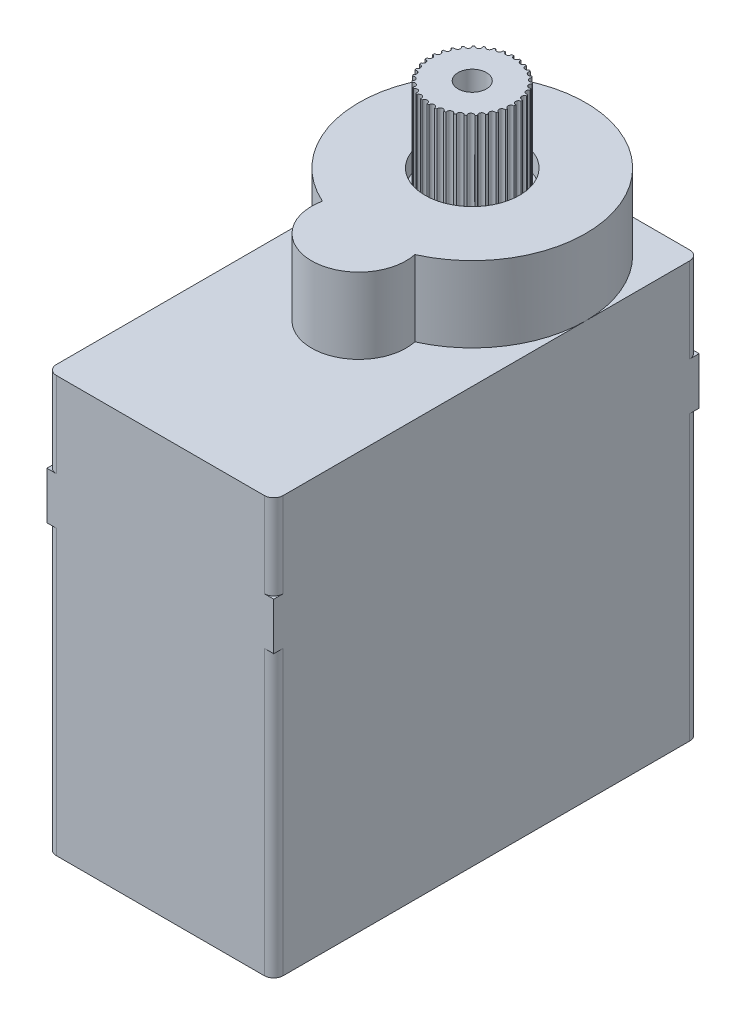
from build123d import *

# Parameters (mm, degrees)
Y_KSEKLIK_EKSTR_ZYON1_DEPTH  = 1
Y_KSEKLIK_EKSTR_ZYON2_DEPTH  = 5
IZIM3_W                      = 4
IZIM3_H                      = 1
KES_EKSTR_ZYON1_DEPTH        = 1
RADYUS1_R                    = 0.1
Y_KSEKLIK_EKSTR_ZYON4_DEPTH  = 9
IZIM6_W                      = 12
IZIM6_H                      = 22.5
Y_KSEKLIK_EKSTR_ZYON5_DEPTH  = 2.5
Y_KSEKLIK_EKSTR_ZYON6_DEPTH  = 3.5
Y_KSEKLIK_EKSTR_ZYON7_DEPTH  = 1
KES_EKSTR_ZYON2_DEPTH        = 1
Y_KSEKLIK_EKSTR_ZYON8_START  = 3
Y_KSEKLIK_EKSTR_ZYON8_DEPTH  = 3
RADYUS2_R                    = 0.5
Y_KSEKLIK_EKSTR_ZYON9_START  = 1
Y_KSEKLIK_EKSTR_ZYON9_DEPTH  = 1
IZIM11_R                     = 2.5
KES_EKSTR_ZYON3_DEPTH        = 10
IZIM15_R                     = 0.25
Y_KSEKLIK_EKSTR_ZYON12_DEPTH = 11
IZIM19_R                     = 2.25
Y_KSEKLIK_EKSTR_ZYON17_DEPTH = 5
IZIM20_R                     = 4.75
Y_KSEKLIK_EKSTR_ZYON18_DEPTH = 3
IZIM21_R                     = 0.75
KES_EKSTR_ZYON5_DEPTH        = 10
IZIM22_R                     = 0.5
Y_KSEKLIK_EKSTR_ZYON19_DEPTH = 5
IZIM23_R                     = 4
Y_KSEKLIK_EKSTR_ZYON20_DEPTH = 2
IZIM24_R                     = 0.75
Y_KSEKLIK_EKSTR_ZYON21_DEPTH = 7
IZIM25_R                     = 3.5
Y_KSEKLIK_EKSTR_ZYON22_DEPTH = 1
IZIM26_R                     = 4.5
Y_KSEKLIK_EKSTR_ZYON23_DEPTH = 1
KES_EKSTR_ZYON7_DEPTH        = 30
Y_KSEKLIK_EKSTR_ZYON33_DEPTH = 1
Y_KSEKLIK_EKSTR_ZYON34_DEPTH = 14
IZIM37_W                     = 8
IZIM37_H                     = 6
Y_KSEKLIK_EKSTR_ZYON36_DEPTH = 1
IZIM39_W                     = 4
IZIM39_H                     = 1
Y_KSEKLIK_EKSTR_ZYON37_DEPTH = 0.1
IZIM40_R                     = 0.4
Y_KSEKLIK_EKSTR_ZYON38_DEPTH = 2
IZIM41_R                     = 0.15
KES_EKSTR_ZYON8_DEPTH        = 5


with BuildPart() as part:
    # Çizim1 → Yükseklik-Ekstrüzyon1 (new body)
    with BuildSketch(Plane(origin=(0, 0, 0), x_dir=(1, 0, 0), z_dir=(0, 1, 0))):
        with BuildLine():
            Line((-5.5, 11.25), (5.5, 11.25))
            ThreePointArc((5.5, 11.25), (5.853553391, 11.103553391), (6, 10.75))
            Line((6, 10.75), (6, -10.75))
            ThreePointArc((6, -10.75), (5.853553391, -11.103553391), (5.5, -11.25))
            Line((5.5, -11.25), (-5.5, -11.25))
            ThreePointArc((-5.5, -11.25), (-5.853553391, -11.103553391), (-6, -10.75))
            Line((-6, -10.75), (-6, 10.75))
            ThreePointArc((-6, 10.75), (-5.853553391, 11.103553391), (-5.5, 11.25))
        make_face()
    extrude(amount=Y_KSEKLIK_EKSTR_ZYON1_DEPTH)

    # Çizim2 → Yükseklik-Ekstrüzyon2 (add)
    with BuildSketch(Plane(origin=(0, 1, 0), x_dir=(1, 0, 0), z_dir=(0, 1, 0))):
        with BuildLine():
            Line((-5.5, 11.25), (5.5, 11.25))
            ThreePointArc((5.5, 11.25), (5.853553391, 11.103553391), (6, 10.75))
            Line((6, 10.75), (6, -10.75))
            ThreePointArc((6, -10.75), (5.853553391, -11.103553391), (5.5, -11.25))
            Line((5.5, -11.25), (-5.5, -11.25))
            ThreePointArc((-5.5, -11.25), (-5.853553391, -11.103553391), (-6, -10.75))
            Line((-6, -10.75), (-6, 10.75))
            ThreePointArc((-6, 10.75), (-5.853553391, 11.103553391), (-5.5, 11.25))
        make_face()
        with BuildLine():
            Line((-5, 9.25), (-5, -9.25))
            ThreePointArc((-5, -9.25), (-4.292893219, -9.542893219), (-4, -10.25))
            Line((-4, -10.25), (4, -10.25))
            ThreePointArc((4, -10.25), (4.292893219, -9.542893219), (5, -9.25))
            Line((5, -9.25), (5, 9.25))
            ThreePointArc((5, 9.25), (4.292893219, 9.542893219), (4, 10.25))
            Line((4, 10.25), (-4, 10.25))
            ThreePointArc((-4, 10.25), (-4.292893219, 9.542893219), (-5, 9.25))
        make_face(mode=Mode.SUBTRACT)
    extrude(amount=Y_KSEKLIK_EKSTR_ZYON2_DEPTH)

    # Çizim3 → Kes-Ekstrüzyon1 (cut)
    with BuildSketch(Plane(origin=(0, 6, 0), x_dir=(1, 0, 0), z_dir=(0, 1, 0))):
        with Locations((0, -10.75)):
            Rectangle(IZIM3_W, IZIM3_H)
    extrude(amount=-KES_EKSTR_ZYON1_DEPTH, mode=Mode.SUBTRACT)

    # Radyus1
    radyus1_edges = [part.edges().sort_by_distance(p)[0] for p in [
        (2, 5, 10.75),
        (-2, 5, 10.75),
    ]]
    fillet(radyus1_edges, radius=RADYUS1_R)

    # Çizim4 → Yükseklik-Ekstrüzyon4 (add)
    with BuildSketch(Plane(origin=(0, 6, 0), x_dir=(1, 0, 0), z_dir=(0, 1, 0))):
        with BuildLine():
            Line((5.5, 11.25), (-5.5, 11.25))
            ThreePointArc((-5.5, 11.25), (-5.853553391, 11.103553391), (-6, 10.75))
            Line((-6, 10.75), (-6, -10.75))
            ThreePointArc((-6, -10.75), (-5.853553391, -11.103553391), (-5.5, -11.25))
            Line((-5.5, -11.25), (-2, -11.25))
            Line((-2, -11.25), (2, -11.25))
            Line((2, -11.25), (5.5, -11.25))
            ThreePointArc((5.5, -11.25), (5.853553391, -11.103553391), (6, -10.75))
            Line((6, -10.75), (6, 10.75))
            ThreePointArc((6, 10.75), (5.853553391, 11.103553391), (5.5, 11.25))
        make_face()
        with BuildLine():
            ThreePointArc((-5, 9.25), (-4.292893219, 9.542893219), (-4, 10.25))
            Line((-4, 10.25), (4, 10.25))
            ThreePointArc((4, 10.25), (4.292893219, 9.542893219), (5, 9.25))
            Line((5, 9.25), (5, -9.25))
            ThreePointArc((5, -9.25), (4.292893219, -9.542893219), (4, -10.25))
            Line((4, -10.25), (2, -10.25))
            Line((2, -10.25), (-2, -10.25))
            Line((-2, -10.25), (-4, -10.25))
            ThreePointArc((-4, -10.25), (-4.292893219, -9.542893219), (-5, -9.25))
            Line((-5, -9.25), (-5, 9.25))
        make_face(mode=Mode.SUBTRACT)
    extrude(amount=Y_KSEKLIK_EKSTR_ZYON4_DEPTH)

    # Çizim6 → Yükseklik-Ekstrüzyon5 (add)
    with BuildSketch(Plane(origin=(0, 15, 0), x_dir=(1, 0, 0), z_dir=(0, 1, 0))):
        Rectangle(IZIM6_W, IZIM6_H)
        with BuildLine():
            Line((-4, 10.25), (4, 10.25))
            ThreePointArc((4, 10.25), (4.292893219, 9.542893219), (5, 9.25))
            Line((5, 9.25), (5, -9.25))
            ThreePointArc((5, -9.25), (4.292893219, -9.542893219), (4, -10.25))
            Line((4, -10.25), (-4, -10.25))
            ThreePointArc((-4, -10.25), (-4.292893219, -9.542893219), (-5, -9.25))
            Line((-5, -9.25), (-5, 9.25))
            ThreePointArc((-5, 9.25), (-4.292893219, 9.542893219), (-4, 10.25))
        make_face(mode=Mode.SUBTRACT)
    extrude(amount=Y_KSEKLIK_EKSTR_ZYON5_DEPTH)

    # Çizim7 → Yükseklik-Ekstrüzyon6 (add)
    with BuildSketch(Plane(origin=(0, 17.5, 0), x_dir=(1, 0, 0), z_dir=(0, 1, 0))):
        with BuildLine():
            Line((5.5, 11.25), (-5.5, 11.25))
            ThreePointArc((-5.5, 11.25), (-5.853553391, 11.103553391), (-6, 10.75))
            Line((-6, 10.75), (-6, -10.75))
            ThreePointArc((-6, -10.75), (-5.853553391, -11.103553391), (-5.5, -11.25))
            Line((-5.5, -11.25), (5.5, -11.25))
            ThreePointArc((5.5, -11.25), (5.853553391, -11.103553391), (6, -10.75))
            Line((6, -10.75), (6, 10.75))
            ThreePointArc((6, 10.75), (5.853553391, 11.103553391), (5.5, 11.25))
        make_face()
        with BuildLine():
            Line((-5, -9.25), (-5, 9.25))
            ThreePointArc((-5, 9.25), (-4.292893219, 9.542893219), (-4, 10.25))
            Line((-4, 10.25), (4, 10.25))
            ThreePointArc((4, 10.25), (4.292893219, 9.542893219), (5, 9.25))
            Line((5, 9.25), (5, -9.25))
            ThreePointArc((5, -9.25), (4.292893219, -9.542893219), (4, -10.25))
            Line((4, -10.25), (-4, -10.25))
            ThreePointArc((-4, -10.25), (-4.292893219, -9.542893219), (-5, -9.25))
        make_face(mode=Mode.SUBTRACT)
    extrude(amount=Y_KSEKLIK_EKSTR_ZYON6_DEPTH)

    # Çizim8 → Yükseklik-Ekstrüzyon7 (add)
    with BuildSketch(Plane(origin=(0, 21, 0), x_dir=(1, 0, 0), z_dir=(0, 1, 0))):
        with BuildLine():
            Line((-5.5, 11.25), (5.5, 11.25))
            ThreePointArc((5.5, 11.25), (5.853553391, 11.103553391), (6, 10.75))
            Line((6, 10.75), (6, -10.75))
            ThreePointArc((6, -10.75), (5.853553391, -11.103553391), (5.5, -11.25))
            Line((5.5, -11.25), (-5.5, -11.25))
            ThreePointArc((-5.5, -11.25), (-5.853553391, -11.103553391), (-6, -10.75))
            Line((-6, -10.75), (-6, 10.75))
            ThreePointArc((-6, 10.75), (-5.853553391, 11.103553391), (-5.5, 11.25))
        make_face()
    extrude(amount=Y_KSEKLIK_EKSTR_ZYON7_DEPTH)

    # Çizim9 → Kes-Ekstrüzyon2 (cut)
    with BuildSketch(Plane(origin=(0, 22, 0), x_dir=(1, 0, 0), z_dir=(0, 1, 0))):
        with BuildLine():
            ThreePointArc((1.015291078, 0.354166667), (0, 10.25), (-1.015291078, 0.354166667))
            ThreePointArc((-1.015291078, 0.354166667), (0, -2.25), (1.015291078, 0.354166667))
        make_face()
    extrude(amount=-KES_EKSTR_ZYON2_DEPTH, mode=Mode.SUBTRACT)

    # Çizim9<3> → Yükseklik-Ekstrüzyon8 (add)
    with BuildSketch(Plane(origin=(0, 22, 0), x_dir=(1, 0, 0), z_dir=(0, 1, 0)).offset(Y_KSEKLIK_EKSTR_ZYON8_START)):
        with BuildLine():
            ThreePointArc((2.445144707, -0.229166667), (0, 11.25), (-2.445144707, -0.229166667))
            ThreePointArc((-2.445144707, -0.229166667), (0, -3.25), (2.445144707, -0.229166667))
        make_face()
        with BuildLine():
            ThreePointArc((1.015291078, 0.354166667), (0, 10.25), (-1.015291078, 0.354166667))
            ThreePointArc((-1.015291078, 0.354166667), (0, -2.25), (1.015291078, 0.354166667))
        make_face(mode=Mode.SUBTRACT)
    extrude(amount=-Y_KSEKLIK_EKSTR_ZYON8_DEPTH)

    # Radyus2
    radyus2_edges = [part.edges().sort_by_distance(p)[0] for p in [
        (1.015291078, 23, -0.354166667),
        (-1.015291078, 23, -0.354166667),
    ]]
    fillet(radyus2_edges, radius=RADYUS2_R)

    # Çizim10 → Yükseklik-Ekstrüzyon9 (add)
    with BuildSketch(Plane(origin=(0, 25, 0), x_dir=(1, 0, 0), z_dir=(0, 1, 0)).offset(Y_KSEKLIK_EKSTR_ZYON9_START)):
        with BuildLine():
            ThreePointArc((2.445144707, -0.229166667), (0, 11.25), (-2.445144707, -0.229166667))
            ThreePointArc((-2.445144707, -0.229166667), (0, -3.25), (2.445144707, -0.229166667))
        make_face()
    extrude(amount=-Y_KSEKLIK_EKSTR_ZYON9_DEPTH)

    # Çizim11 → Kes-Ekstrüzyon3 (cut)
    with BuildSketch(Plane(origin=(0, 26, 0), x_dir=(1, 0, 0), z_dir=(0, 1, 0))):
        with Locations((0, 5.25)):
            Circle(IZIM11_R)
    extrude(amount=-KES_EKSTR_ZYON3_DEPTH, mode=Mode.SUBTRACT)

    # Çizim15 → Yükseklik-Ekstrüzyon12 (add)
    with BuildSketch(Plane(origin=(0, 26, 0), x_dir=(1, 0, 0), z_dir=(0, 1, 0))):
        with Locations((0, -0.75)):
            Circle(IZIM15_R)
    extrude(amount=-Y_KSEKLIK_EKSTR_ZYON12_DEPTH)



with BuildPart() as body_2:
    # Çizim19 → Yükseklik-Ekstrüzyon17 (new body)
    with BuildSketch(Plane(origin=(0, 30, 0), x_dir=(1, 0, 0), z_dir=(0, 1, 0))):
        with Locations((0, 5.25)):
            Circle(IZIM19_R)
    extrude(amount=-Y_KSEKLIK_EKSTR_ZYON17_DEPTH)


with BuildPart() as part_1:
    add(part.part)

    add(body_2.part)  # Yükseklik-Ekstrüzyon18 merges body 2
    # Çizim20 → Yükseklik-Ekstrüzyon18 (add)
    with BuildSketch(Plane.XZ.offset(-25)):
        with Locations((0, -5.25)):
            Circle(IZIM20_R)
    extrude(amount=Y_KSEKLIK_EKSTR_ZYON18_DEPTH)

    # Çizim21 → Kes-Ekstrüzyon5 (cut)
    with BuildSketch(Plane(origin=(0, 30, 0), x_dir=(1, 0, 0), z_dir=(0, 1, 0))):
        with Locations((0, 5.25)):
            Circle(IZIM21_R)
    extrude(amount=-KES_EKSTR_ZYON5_DEPTH, mode=Mode.SUBTRACT)

    # Çizim22 → Yükseklik-Ekstrüzyon19 (add)
    with BuildSketch(Plane(origin=(0, 25.5, 0), x_dir=(1, 0, 0), z_dir=(0, 1, 0))):
        with Locations((0, -0.75)):
            Circle(IZIM22_R)
    extrude(amount=-Y_KSEKLIK_EKSTR_ZYON19_DEPTH)

    # Çizim23 → Yükseklik-Ekstrüzyon20 (add)
    with BuildSketch(Plane.XZ.offset(-20.5)):
        with Locations((0, 0.75)):
            Circle(IZIM23_R)
    extrude(amount=Y_KSEKLIK_EKSTR_ZYON20_DEPTH)

    # Çizim26 → Yükseklik-Ekstrüzyon23 (add)
    with BuildSketch(Plane(origin=(0, 17.5, 0), x_dir=(-1, 0, 0), z_dir=(0, -1, 0))):
        with Locations((0, -0.75)):
            Circle(IZIM26_R)
    extrude(amount=Y_KSEKLIK_EKSTR_ZYON23_DEPTH)

    # Çizim32 → Kes-Ekstrüzyon7 (cut)
    with BuildSketch(Plane(origin=(0, 0, 10.25), x_dir=(-1, 0, 0), z_dir=(0, 0, -1))):
        with BuildLine():
            Line((2, 6), (-2, 6))
            Line((-2, 6), (-2, 5.1))
            ThreePointArc((-2, 5.1), (-1.970710678, 5.029289322), (-1.9, 5))
            Line((-1.9, 5), (1.9, 5))
            ThreePointArc((1.9, 5), (1.970710678, 5.029289322), (2, 5.1))
            Line((2, 5.1), (2, 6))
        make_face()
    extrude(amount=KES_EKSTR_ZYON7_DEPTH, mode=Mode.SUBTRACT)

    # Çizim33 → Yükseklik-Ekstrüzyon33 (add)
    with BuildSketch(Plane.XY.offset(11.25)):
        with BuildLine():
            Line((-2, 6), (2, 6))
            Line((2, 6), (2, 5.1))
            ThreePointArc((2, 5.1), (1.970710678, 5.029289322), (1.9, 5))
            Line((1.9, 5), (-1.9, 5))
            ThreePointArc((-1.9, 5), (-1.970710678, 5.029289322), (-2, 5.1))
            Line((-2, 5.1), (-2, 6))
        make_face()
    extrude(amount=-Y_KSEKLIK_EKSTR_ZYON33_DEPTH)

    # Çizim34 → Yükseklik-Ekstrüzyon34 (add)
    with BuildSketch(Plane(origin=(0, 1, 0), x_dir=(1, 0, 0), z_dir=(0, 1, 0))):
        with BuildLine():
            Line((-3, -3.25), (3, -3.25))
            ThreePointArc((3, -3.25), (3.707106781, -3.542893219), (4, -4.25))
            Line((4, -4.25), (4, -8.25))
            ThreePointArc((4, -8.25), (3.707106781, -8.957106781), (3, -9.25))
            Line((3, -9.25), (-3, -9.25))
            ThreePointArc((-3, -9.25), (-3.707106781, -8.957106781), (-4, -8.25))
            Line((-4, -8.25), (-4, -4.25))
            ThreePointArc((-4, -4.25), (-3.707106781, -3.542893219), (-3, -3.25))
        make_face()
    extrude(amount=Y_KSEKLIK_EKSTR_ZYON34_DEPTH)

    # Çizim37 → Yükseklik-Ekstrüzyon36 (add)
    with BuildSketch(Plane(origin=(0, 1, 0), x_dir=(-1, 0, 0), z_dir=(0, -1, 0))):
        with Locations((0, -6.25)):
            Rectangle(IZIM37_W, IZIM37_H)
    extrude(amount=-Y_KSEKLIK_EKSTR_ZYON36_DEPTH)

    # Çizim39 → Yükseklik-Ekstrüzyon37 (add)
    with BuildSketch(Plane(origin=(0, 0, -10.75), x_dir=(-1, 0, 0), z_dir=(0, 0, -1))):
        with Locations((0, 5.514566781)):
            Rectangle(IZIM39_W, IZIM39_H)
    extrude(amount=Y_KSEKLIK_EKSTR_ZYON37_DEPTH)

    # Çizim40 → Yükseklik-Ekstrüzyon38 (add)
    with BuildSketch(Plane(origin=(0, 0, -10.85), x_dir=(-1, 0, 0), z_dir=(0, 0, -1))):
        with Locations((0, 5.55)):
            Circle(IZIM40_R)
        with Locations((1, 5.55)):
            Circle(IZIM40_R)
        with Locations((-1, 5.55)):
            Circle(IZIM40_R)
    extrude(amount=Y_KSEKLIK_EKSTR_ZYON38_DEPTH)

    # Çizim41 → Kes-Ekstrüzyon8 (cut)
    with BuildSketch(Plane(origin=(0, 30, 0), x_dir=(1, 0, 0), z_dir=(0, 1, 0))):
        with Locations((-2.25, 5.25)):
            Circle(IZIM41_R)
        with Locations((-2.213841574, 5.651753013)):
            Circle(IZIM41_R)
        with Locations((-2.213841574, 4.848246987)):
            Circle(IZIM41_R)
        with Locations((-2.106528459, 6.040593354)):
            Circle(IZIM41_R)
        with Locations((-2.106528459, 4.459406646)):
            Circle(IZIM41_R)
        with Locations((-1.931509786, 6.404023374)):
            Circle(IZIM41_R)
        with Locations((-1.931509786, 4.095976626)):
            Circle(IZIM41_R)
        with Locations((-1.694410799, 6.730362133)):
            Circle(IZIM41_R)
        with Locations((-1.694410799, 3.769637867)):
            Circle(IZIM41_R)
        with Locations((-1.402852054, 7.009120836)):
            Circle(IZIM41_R)
        with Locations((-1.402852054, 3.490879164)):
            Circle(IZIM41_R)
        with Locations((-1.066204491, 7.231339947)):
            Circle(IZIM41_R)
        with Locations((-1.066204491, 3.268660053)):
            Circle(IZIM41_R)
        with Locations((-0.695288237, 7.389877162)):
            Circle(IZIM41_R)
        with Locations((-0.695288237, 3.110122838)):
            Circle(IZIM41_R)
        with Locations((-0.302024848, 7.479636964)):
            Circle(IZIM41_R)
        with Locations((-0.302024848, 3.020363036)):
            Circle(IZIM41_R)
        with Locations((0.100945868, 7.4977344)):
            Circle(IZIM41_R)
        with Locations((0.100945868, 3.0022656)):
            Circle(IZIM41_R)
        with Locations((0.500672101, 7.443587802)):
            Circle(IZIM41_R)
        with Locations((0.500672101, 3.056412198)):
            Circle(IZIM41_R)
        with Locations((0.884306321, 7.318937488)):
            Circle(IZIM41_R)
        with Locations((0.884306321, 3.181062512)):
            Circle(IZIM41_R)
        with Locations((1.239518208, 7.127789821)):
            Circle(IZIM41_R)
        with Locations((1.239518208, 3.372210179)):
            Circle(IZIM41_R)
        with Locations((1.55489096, 6.876288444)):
            Circle(IZIM41_R)
        with Locations((1.55489096, 3.623711556)):
            Circle(IZIM41_R)
        with Locations((1.820288237, 6.572516818)):
            Circle(IZIM41_R)
        with Locations((1.820288237, 3.927483182)):
            Circle(IZIM41_R)
        with Locations((2.027179953, 6.226238413)):
            Circle(IZIM41_R)
        with Locations((2.027179953, 4.273761587)):
            Circle(IZIM41_R)
        with Locations((2.168916437, 5.848582903)):
            Circle(IZIM41_R)
        with Locations((2.168916437, 4.651417097)):
            Circle(IZIM41_R)
        with Locations((2.240942161, 5.451688445)):
            Circle(IZIM41_R)
        with Locations((2.240942161, 5.048311555)):
            Circle(IZIM41_R)
    extrude(amount=-KES_EKSTR_ZYON8_DEPTH, mode=Mode.SUBTRACT)


with BuildPart() as body_2_2:
    # Çizim24 → Yükseklik-Ekstrüzyon21 (new body)
    with BuildSketch(Plane.XZ.offset(-22)):
        with Locations((0, -5.25)):
            Circle(IZIM24_R)
    extrude(amount=Y_KSEKLIK_EKSTR_ZYON21_DEPTH)

    # Çizim25 → Yükseklik-Ekstrüzyon22 (add)
    with BuildSketch(Plane(origin=(0, 19, 0), x_dir=(-1, 0, 0), z_dir=(0, -1, 0))):
        with Locations((0, 5.25)):
            Circle(IZIM25_R)
    extrude(amount=Y_KSEKLIK_EKSTR_ZYON22_DEPTH)


solid = Compound([part_1.part, body_2_2.part])
